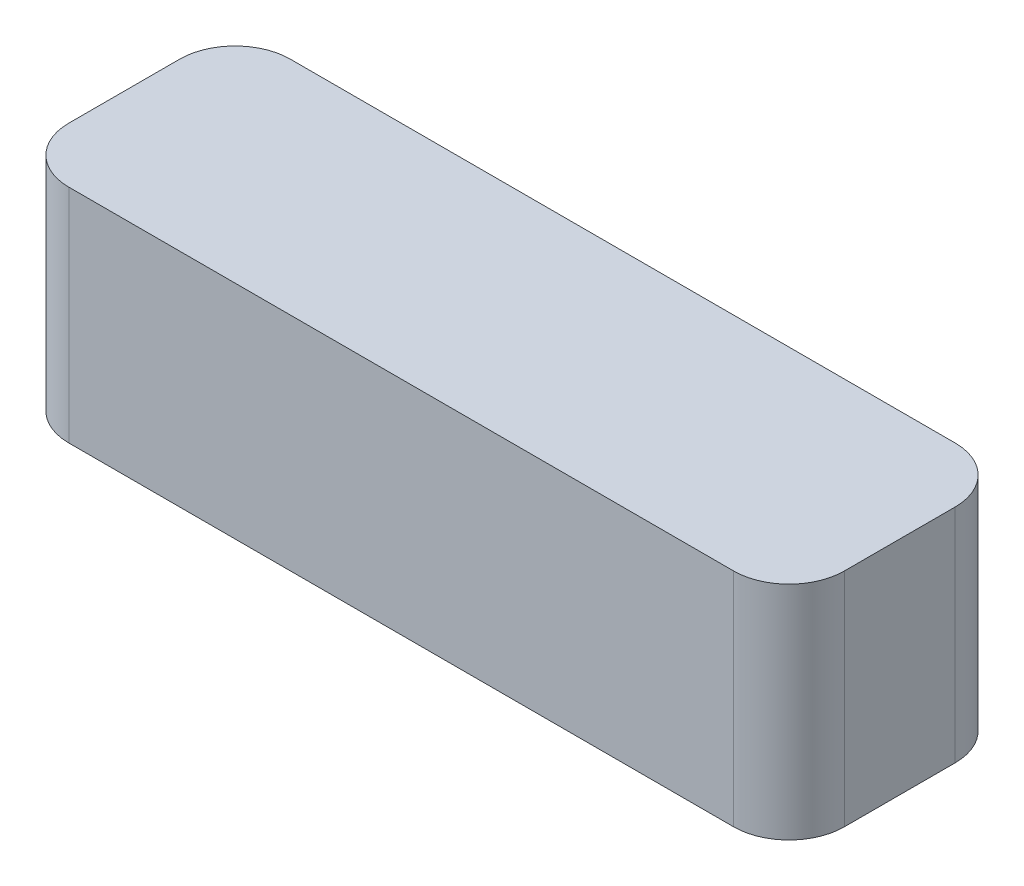
from build123d import *

# Parameters (mm, degrees)
BOSS_EXTRUDE1_DEPTH = 4


with BuildPart() as part:
    # Sketch1 → Boss-Extrude1 (new body)
    with BuildSketch(Plane(origin=(0, 0, 0), x_dir=(1, 0, 0), z_dir=(0, 1, 0))):
        with BuildLine():
            Line((-6, 2), (6, 2))
            ThreePointArc((6, 2), (6.707106781, 1.707106781), (7, 1))
            Line((7, 1), (7, -1))
            ThreePointArc((7, -1), (6.707106781, -1.707106781), (6, -2))
            Line((6, -2), (-6, -2))
            ThreePointArc((-6, -2), (-6.707106781, -1.707106781), (-7, -1))
            Line((-7, -1), (-7, 1))
            ThreePointArc((-7, 1), (-6.707106781, 1.707106781), (-6, 2))
        make_face()
    extrude(amount=BOSS_EXTRUDE1_DEPTH)


solid = part.part
